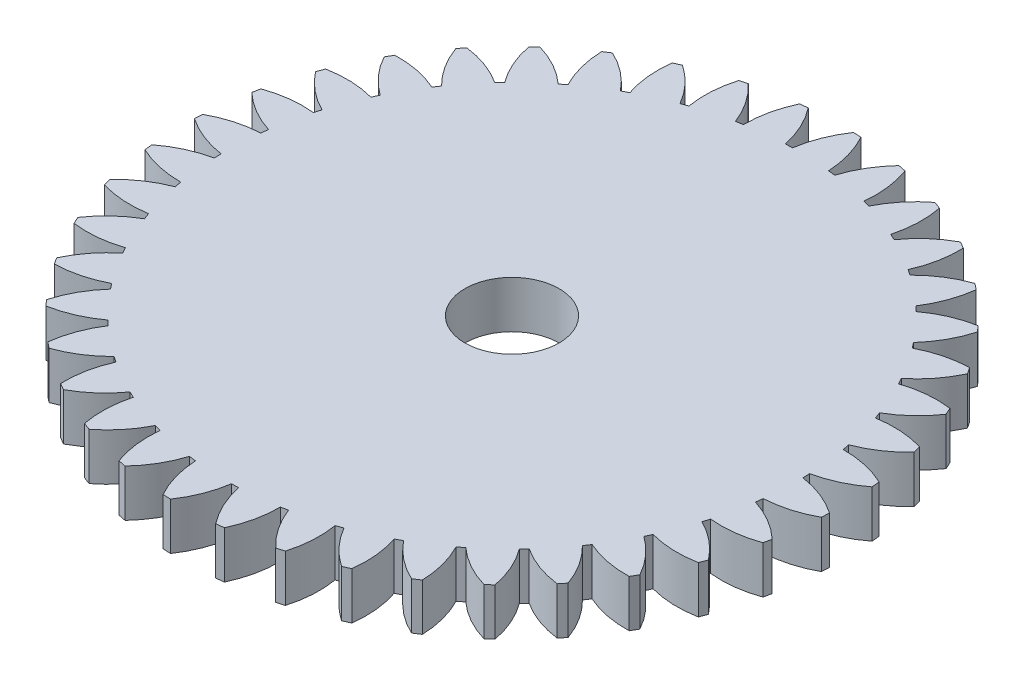
from build123d import *

# Parameters (mm, degrees)
CROQUIS2_R              = 10.5
CROQUIS2_R_2            = 1.5
SALIENTE_EXTRUIR1_DEPTH = 1.5
CORTAR_EXTRUIR1_DEPTH   = 16
MATRIZC1_COUNT          = 40


with BuildPart() as part:
    # Croquis2 → Saliente-Extruir1 (new body)
    with BuildSketch(Plane(origin=(0, 0, 0), x_dir=(1, 0, 0), z_dir=(0, 1, 0))):
        with Locations(Location((0, 0, 0), (0, 0, 270))):
            Circle(CROQUIS2_R)
        with Locations(Location((0, 0, 0), (0, 0, 270))):
            Circle(CROQUIS2_R_2, mode=Mode.SUBTRACT)
    extrude(amount=SALIENTE_EXTRUIR1_DEPTH)

    # Croquis1 → Cortar-Extruir1 (cut)
    with BuildSketch(Plane(origin=(0, 0, 0), x_dir=(1, 0, 0), z_dir=(0, 1, 0))):
        with BuildLine():
            ThreePointArc((0.381809846, 10.493055858), (-0.318156309, 10.495178729), (-1.01670856, 10.450660443))
            ThreePointArc((-1.01670856, 10.450660443), (-0.624255204, 9.807078131), (-0.386377044, 9.091793705))
            ThreePointArc((-0.386377044, 9.091793705), (-0.275735468, 9.095821566), (-0.165053076, 9.098503035))
            ThreePointArc((-0.165053076, 9.098503035), (0.029061087, 9.826883101), (0.381809846, 10.493055858))
        make_face()
    cortar_extruir1 = extrude(amount=CORTAR_EXTRUIR1_DEPTH, mode=Mode.SUBTRACT)

    # MatrizC1: Cortar-Extruir1 ×40 about axis
    matrizc1_axis = Axis((0, 0, 0), (0, 1, 0))
    for i in range(1, MATRIZC1_COUNT):
        add(cortar_extruir1.rotate(matrizc1_axis, i * 360 / MATRIZC1_COUNT), mode=Mode.SUBTRACT)


solid = part.part
